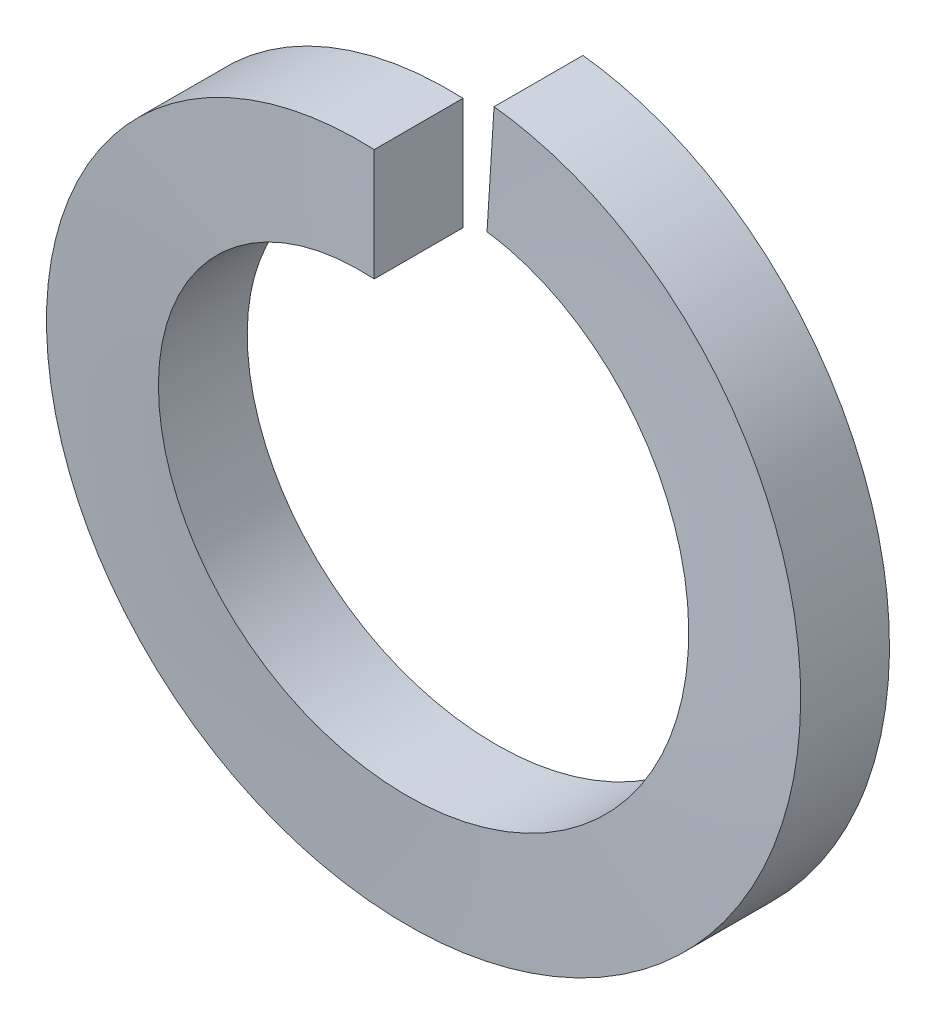
from build123d import *

# Parameters (mm, degrees)
SWEEP1_PITCH       = 1.749777778
SWEEP1_HEIGHT      = 1.73228
SWEEP1_RADIUS      = 6.24205
SWEEP1_START_ANGLE = 90
SKETCH2_W          = 1.5748
SKETCH2_H          = 1.98755


with BuildPart() as part:
    # Sweep1: sweep along a helix
    with BuildLine() as sweep1_path:
        add(Helix(SWEEP1_PITCH, SWEEP1_HEIGHT, SWEEP1_RADIUS, center=(0, 0, 0), direction=(0, 0, -1), lefthand=True, mode=Mode.PRIVATE).rotate(Axis((0, 0, 0), (0, 0, -1)), SWEEP1_START_ANGLE))
    # Sketch2 → Sweep1 (sweep)
    with BuildSketch(Plane(origin=(0, 0, 0), x_dir=(0, 0, -1), z_dir=(1, 0, 0))):
        with Locations((-0.7874, 5.248275)):
            Rectangle(SKETCH2_W, SKETCH2_H)
    sweep(path=sweep1_path.line, is_frenet=True)


solid = part.part
